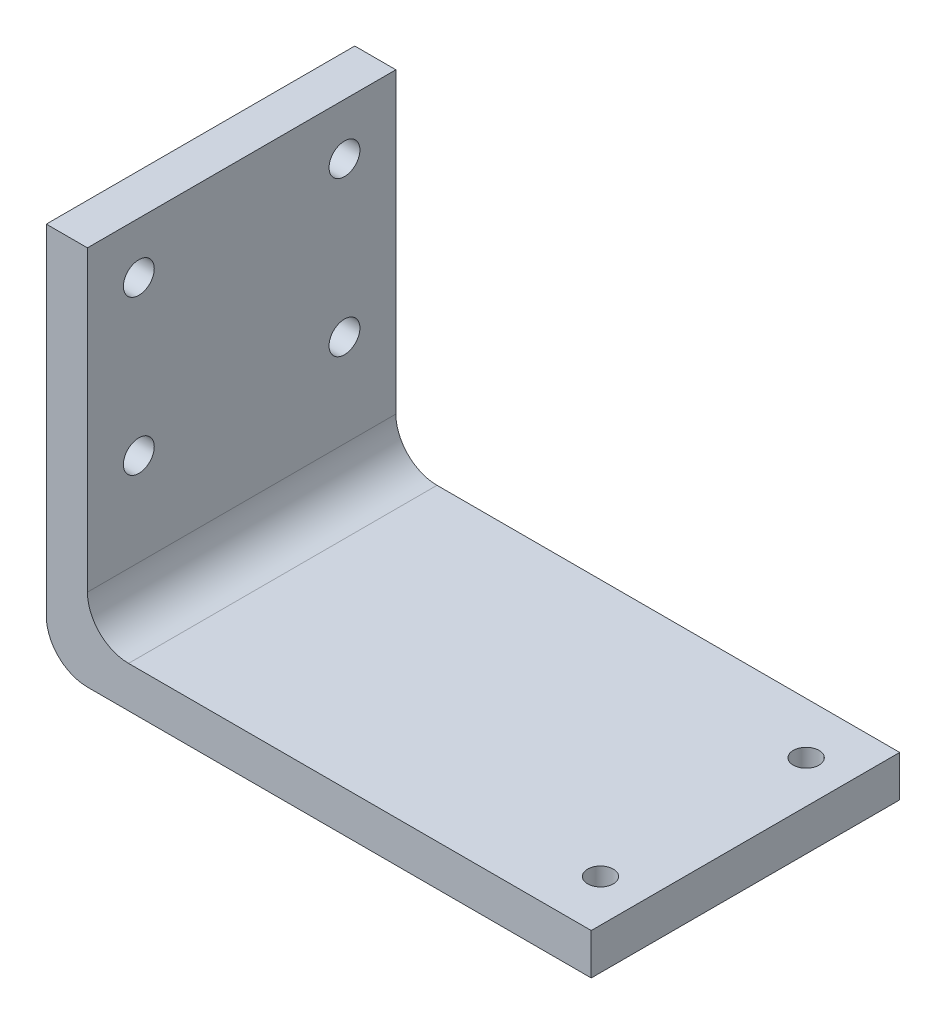
from build123d import *

# Parameters (mm, degrees)
BOSS_EXTRUDE1_DEPTH              = 38.1
F_1_8_0_125_DIAMETER_HOLE1_D     = 3.175
F_1_8_0_125_DIAMETER_HOLE1_DEPTH = 5.08
F_1_8_0_125_DIAMETER_HOLE1_TIP   = 0.953866233
F_1_8_0_15_DIAMETER_HOLE1_D      = 3.81
F_1_8_0_15_DIAMETER_HOLE1_DEPTH  = 5.08
F_1_8_0_15_DIAMETER_HOLE1_TIP    = 1.144639479


with BuildPart() as part:
    # Sketch1 → Boss-Extrude1 (new body)
    with BuildSketch(Plane.XY):
        with BuildLine():
            Line((5.08, 0), (67.31, 0))
            Line((67.31, 0), (67.31, 5.08))
            Line((67.31, 5.08), (10.16, 5.08))
            ThreePointArc((10.16, 5.08), (6.567897552, 6.567897552), (5.08, 10.16))
            Line((5.08, 10.16), (5.08, 46.99))
            Line((5.08, 46.99), (0, 46.99))
            Line((0, 46.99), (0, 5.08))
            ThreePointArc((0, 5.08), (1.487897552, 1.487897552), (5.08, 0))
        make_face()
    extrude(amount=BOSS_EXTRUDE1_DEPTH)

    # 1/8 (0.125) Diameter Hole1
    with Locations(Plane(origin=(0, 5.08, 0), x_dir=(1, 0, 0), z_dir=(0, 1, 0))):
        with Locations((62.103, -31.75), (62.103, -6.35)):
            Hole(F_1_8_0_125_DIAMETER_HOLE1_D / 2, depth=F_1_8_0_125_DIAMETER_HOLE1_DEPTH)
            with Locations((0, 0, -(F_1_8_0_125_DIAMETER_HOLE1_DEPTH + F_1_8_0_125_DIAMETER_HOLE1_TIP / 2))):  # 118° drill point
                Cone(0, F_1_8_0_125_DIAMETER_HOLE1_D / 2, F_1_8_0_125_DIAMETER_HOLE1_TIP, mode=Mode.SUBTRACT)

    # 1/8 (0.15) Diameter Hole1
    with Locations(Plane(origin=(5.08, 0, 0), x_dir=(0, 0, -1), z_dir=(1, 0, 0))):
        with Locations((-31.75, 40.64), (-6.35, 40.64), (-6.35, 21.59), (-31.75, 21.59)):
            Hole(F_1_8_0_15_DIAMETER_HOLE1_D / 2, depth=F_1_8_0_15_DIAMETER_HOLE1_DEPTH)
            with Locations((0, 0, -(F_1_8_0_15_DIAMETER_HOLE1_DEPTH + F_1_8_0_15_DIAMETER_HOLE1_TIP / 2))):  # 118° drill point
                Cone(0, F_1_8_0_15_DIAMETER_HOLE1_D / 2, F_1_8_0_15_DIAMETER_HOLE1_TIP, mode=Mode.SUBTRACT)


solid = part.part
